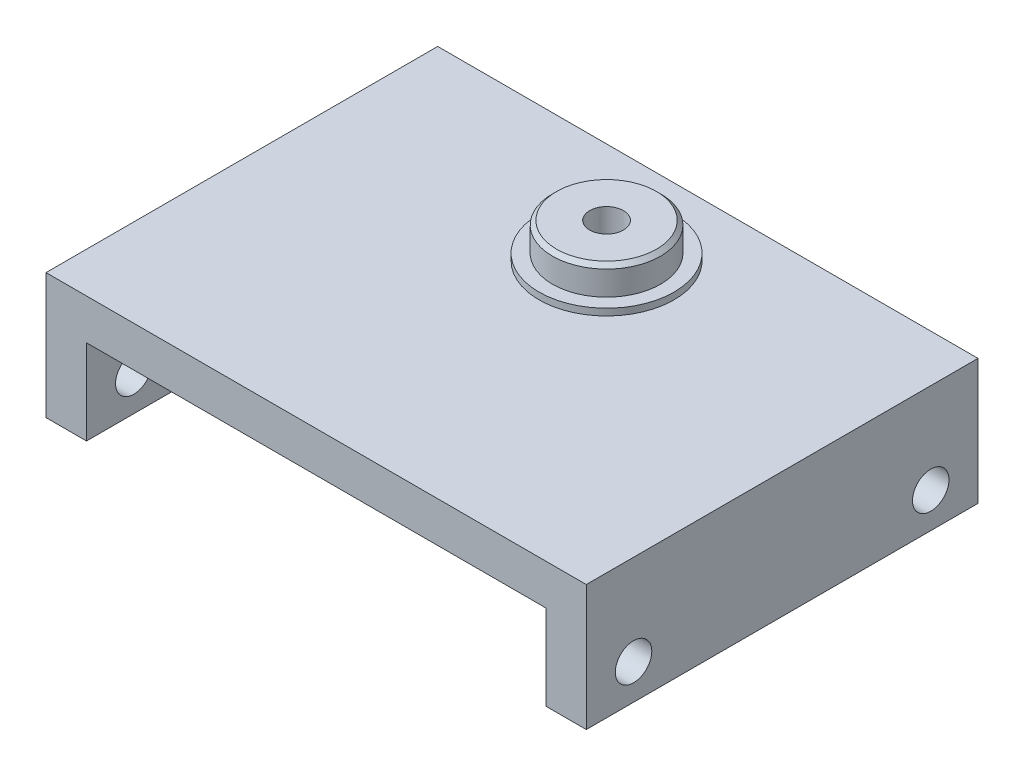
from build123d import *

# Parameters (mm, degrees)
EXTRUDE_1_DEPTH         = 29
HOLE_WIZARD_2_7_2_7_1_D = 2.7
SKETCH_4_R              = 4
EXTRUDE_2_DEPTH         = 2.6
SKETCH_5_R              = 5
EXTRUDE_3_DEPTH         = 0.5
HOLE_WIZARD_M3_1_D      = 2.5
CHAMFER_2_SIZE          = 0.3


with BuildPart() as part:
    # 草图1 → 凸台-拉伸1 (new body)
    with BuildSketch(Plane.XY):
        Polygon((20, 0), (-20, 0), (-20, -9.3), (-17, -9.3), (-17, -3), (17, -3), (17, -9.3), (20, -9.3), align=None)
    extrude(amount=EXTRUDE_1_DEPTH)

    # Ø2.7 (2.7) 直径孔1 (through all)
    with Locations(Plane(origin=(20, 0, 0), x_dir=(0, 0, -1), z_dir=(1, 0, 0))):
        with Locations((-25.5, -6.7), (-3.5, -6.7)):
            Hole(HOLE_WIZARD_2_7_2_7_1_D / 2)

    # 草图4 → 凸台-拉伸2 (add)
    with BuildSketch(Plane(origin=(0, 0, 0), x_dir=(1, 0, 0), z_dir=(0, 1, 0))):
        with Locations(Location((0, -7.5, 0), (0, 0, 90))):
            Circle(SKETCH_4_R)
    extrude(amount=EXTRUDE_2_DEPTH)

    # 草图5 → 凸台-拉伸3 (add)
    with BuildSketch(Plane(origin=(0, 0, 0), x_dir=(1, 0, 0), z_dir=(0, 1, 0))):
        with Locations(Location((0, -7.5, 0), (0, 0, 90))):
            Circle(SKETCH_5_R)
    extrude(amount=EXTRUDE_3_DEPTH)

    # M3 螺纹孔的螺纹孔钻头1 (through all)
    with Locations(Plane(origin=(0, 2.6, 0), x_dir=(1, 0, 0), z_dir=(0, 1, 0))):
        with Locations((0, -7.5)):
            Hole(HOLE_WIZARD_M3_1_D / 2)

    # 倒角2
    chamfer_2_edges = [part.edges().sort_by_distance(p)[0] for p in [
        (0, 2.6, 11.5),
    ]]
    chamfer(chamfer_2_edges, length=CHAMFER_2_SIZE)


solid = part.part
